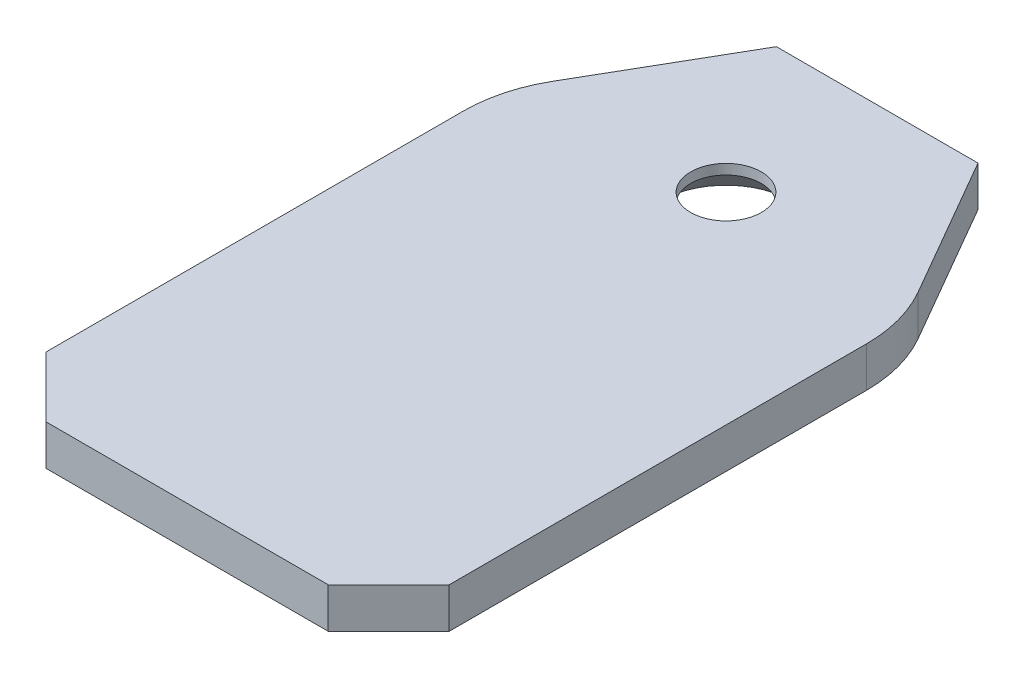
from build123d import *

# Parameters (mm, degrees)
EXTRUDE_1_DEPTH     = 2
SKETCH_3_R          = 1.75
CUT_EXTRUDE_1_DEPTH = 10
CHAMFER_1_SIZE      = 3
CHAMFER_2_SIZE      = 1.5


with BuildPart() as part:
    # Эскиз2 → Бобышка-Вытянуть1 (new body)
    with BuildSketch(Plane(origin=(0, 0, 0), x_dir=(1, 0, 0), z_dir=(0, 1, 0))):
        with BuildLine():
            Line((-1.183478947, -7.641318816), (-1.183478947, -30.873613644))
            Line((-1.183478947, -30.873613644), (-21.183478947, -30.873613644))
            Line((-21.183478947, -30.873613644), (-21.183478947, -7.641318816))
            Line((-21.183478947, -7.641318816), (-21.183478947, -7.177217201))
            ThreePointArc((-21.183478947, -7.177217201), (-20.944959731, -5.365483885), (-20.245656774, -3.677217201))
            Line((-20.245656774, -3.677217201), (-16.183478947, 3.358681184))
            Line((-16.183478947, 3.358681184), (-6.183478947, 3.358681184))
            Line((-6.183478947, 3.358681184), (-2.121301121, -3.677217201))
            ThreePointArc((-2.121301121, -3.677217201), (-1.421998163, -5.365483885), (-1.183478947, -7.177217201))
            Line((-1.183478947, -7.177217201), (-1.183478947, -7.641318816))
        make_face()
    extrude(amount=-EXTRUDE_1_DEPTH)

    # Эскиз3 → Вырез-Вытянуть1 (cut)
    with BuildSketch(Plane.XZ.offset(2)):
        with Locations(Location((-11.183478947, 4.141318816, 0), (0, 0, 270))):
            Circle(SKETCH_3_R)
    extrude(amount=-CUT_EXTRUDE_1_DEPTH, mode=Mode.SUBTRACT)

    # Фаска1
    chamfer_1_edges = [part.edges().sort_by_distance(p)[0] for p in [
        (-1.183478947, -1, 30.873613644),
        (-21.183478947, -1, 30.873613644),
    ]]
    chamfer(chamfer_1_edges, length=CHAMFER_1_SIZE)

    # Фаска2
    chamfer_2_edges = [part.edges().sort_by_distance(p)[0] for p in [
        (-11.183478947, -2, 5.891318816),
    ]]
    chamfer(chamfer_2_edges, length=CHAMFER_2_SIZE)


solid = part.part
